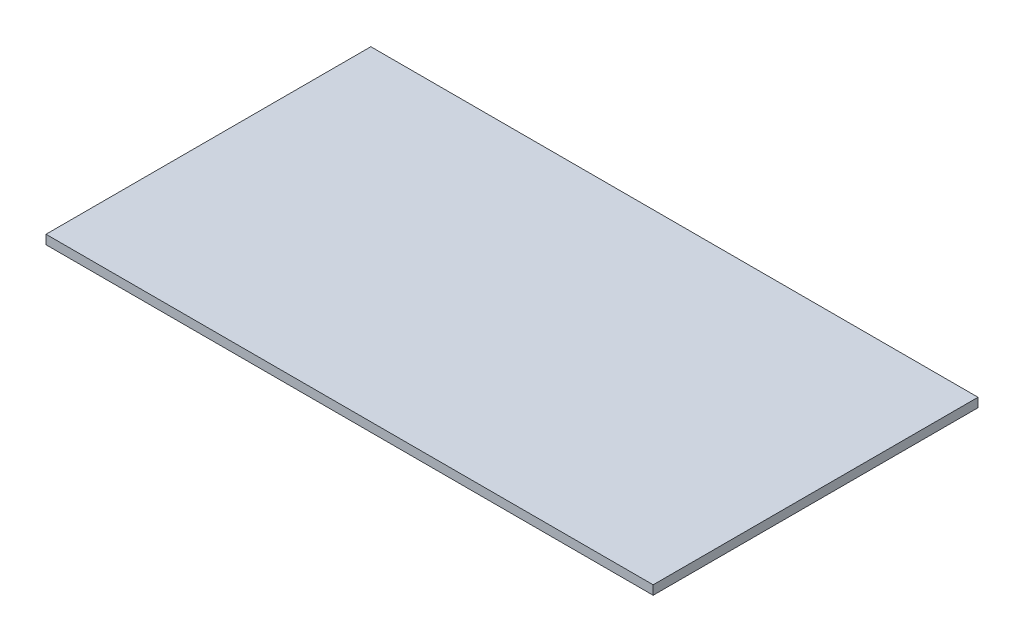
from build123d import *

# Parameters (mm, degrees)
SKETCH1_W           = 1000
SKETCH1_H           = 535
BOSS_EXTRUDE1_DEPTH = 15


with BuildPart() as part:
    # Sketch1 → Boss-Extrude1 (new body)
    with BuildSketch(Plane(origin=(0, 0, 0), x_dir=(1, 0, 0), z_dir=(0, 1, 0))):
        Rectangle(SKETCH1_W, SKETCH1_H)
    extrude(amount=BOSS_EXTRUDE1_DEPTH)


solid = part.part
